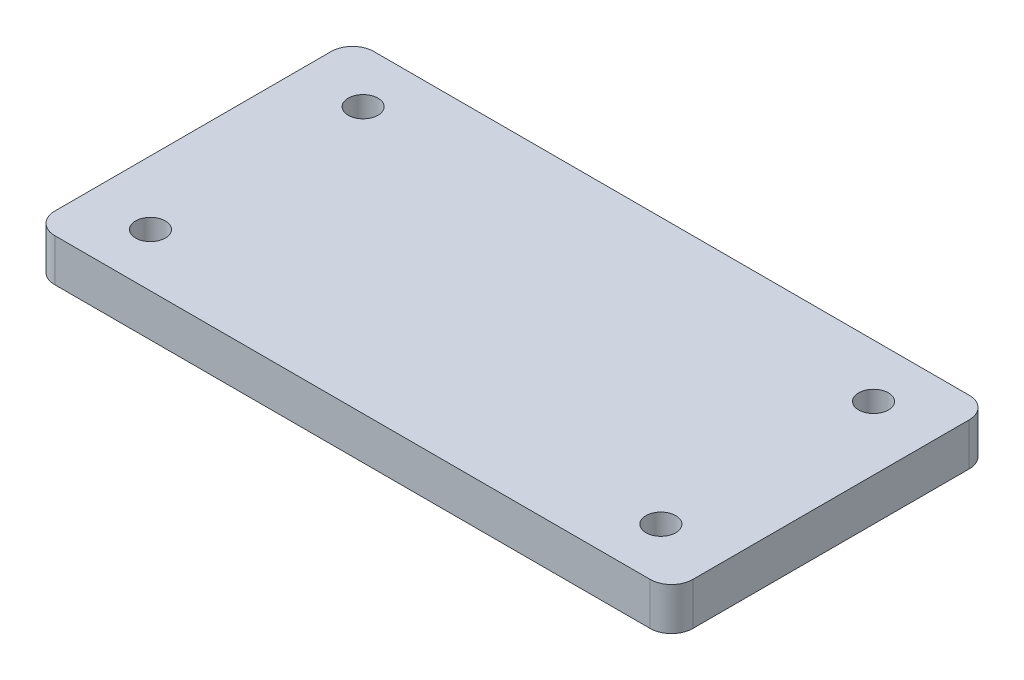
from build123d import *

# Parameters (mm, degrees)
SKETCH1_W           = 300
SKETCH1_H           = 150
BOSS_EXTRUDE1_DEPTH = 20
FILLET1_R           = 10
M16_TAPPED_HOLE1_D  = 14


with BuildPart() as part:
    # Sketch1 → Boss-Extrude1 (new body)
    with BuildSketch(Plane(origin=(0, 0, 0), x_dir=(1, 0, 0), z_dir=(0, 1, 0))):
        Rectangle(SKETCH1_W, SKETCH1_H)
    extrude(amount=BOSS_EXTRUDE1_DEPTH)

    # Fillet1
    fillet1_edges = [part.edges().sort_by_distance(p)[0] for p in [
        (150, 10, 75),
        (-150, 10, 75),
        (-150, 10, -75),
        (150, 10, -75),
    ]]
    fillet(fillet1_edges, radius=FILLET1_R)

    # M16 Tapped Hole1 (through all)
    with Locations(Plane(origin=(-120, 20, -50), x_dir=(0, 0, 1), z_dir=(0, 1, 0))):
        with Locations((0, 0), (0, 240), (100, 240), (100, 0)):
            Hole(M16_TAPPED_HOLE1_D / 2)


solid = part.part
